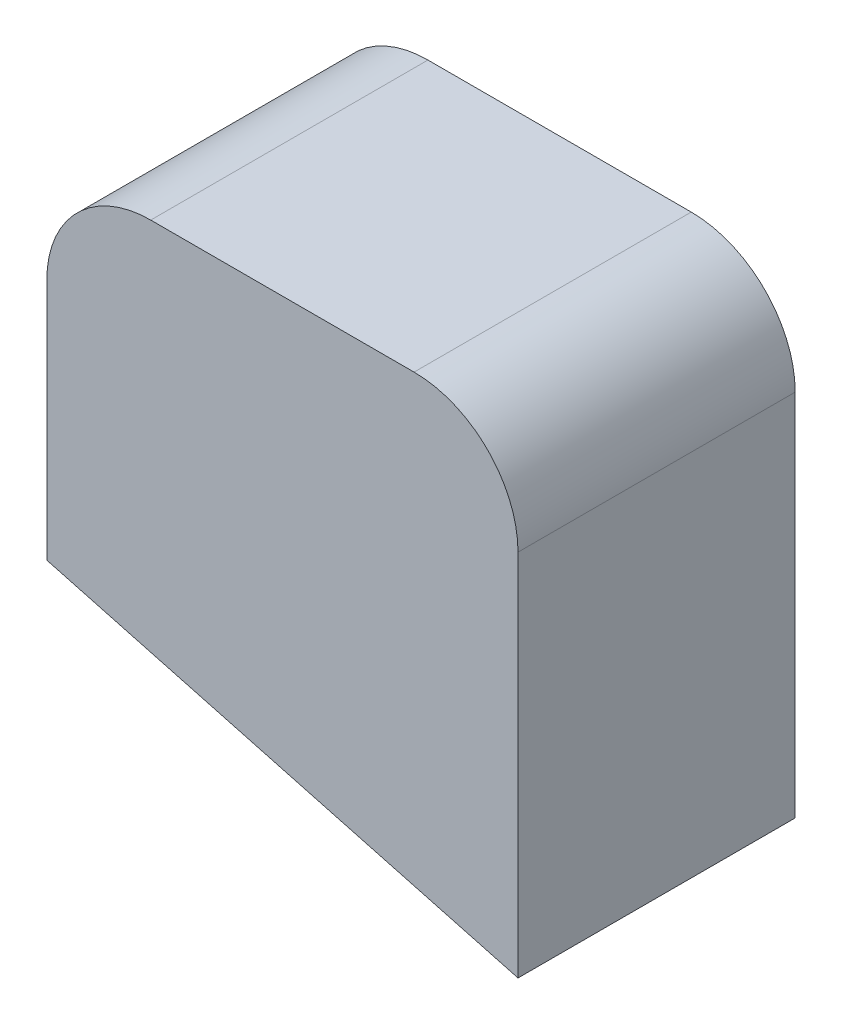
from build123d import *

# Parameters (mm, degrees)
SALIENTE_EXTRUIR1_DEPTH = 8
REDONDEO1_R             = 3


with BuildPart() as part:
    # Croquis1 → Saliente-Extruir1 (new body)
    with BuildSketch(Plane.XY):
        Polygon((-13.6, 3.644109017), (0, 0), (0, 13.644109017), (-13.6, 13.644109017), align=None)
    extrude(amount=SALIENTE_EXTRUIR1_DEPTH)

    # Redondeo1
    redondeo1_edges = [part.edges().sort_by_distance(p)[0] for p in [
        (0, 13.644109017, 4),
        (-13.6, 13.644109017, 4),
    ]]
    fillet(redondeo1_edges, radius=REDONDEO1_R)


solid = part.part
